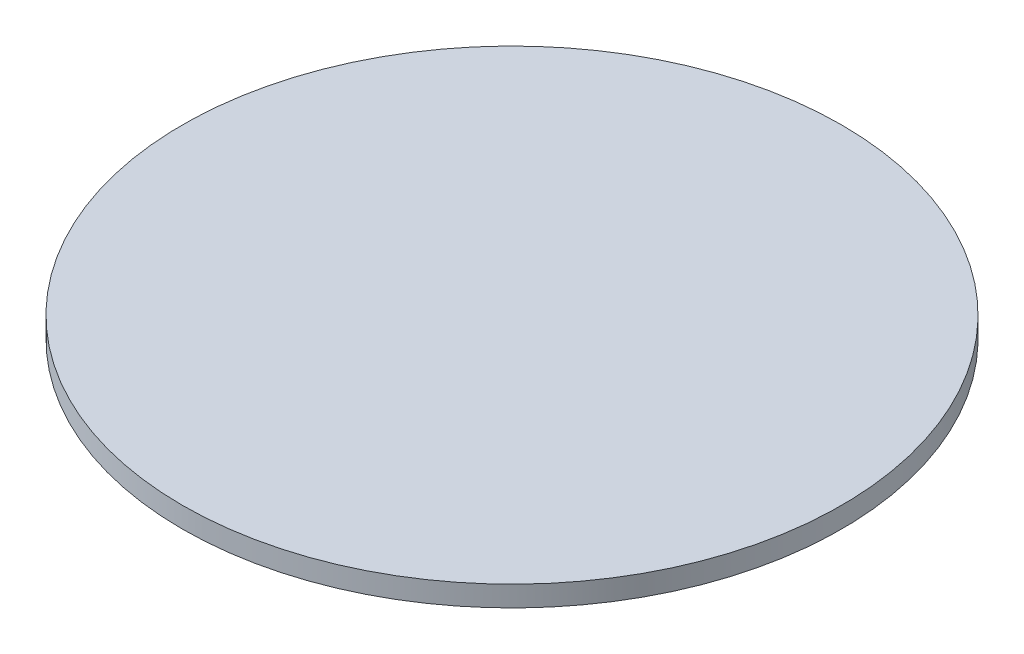
from build123d import *

# Parameters (mm, degrees)
SKETCH1_R           = 25.4
BOSS_EXTRUDE1_DEPTH = 1.5875


with BuildPart() as part:
    # Sketch1 → Boss-Extrude1 (new body)
    with BuildSketch(Plane(origin=(0, 0, 0), x_dir=(1, 0, 0), z_dir=(0, 1, 0))):
        with Locations(Location((0, 0, 0), (0, 0, 270))):
            Circle(SKETCH1_R)
    extrude(amount=BOSS_EXTRUDE1_DEPTH)


solid = part.part
